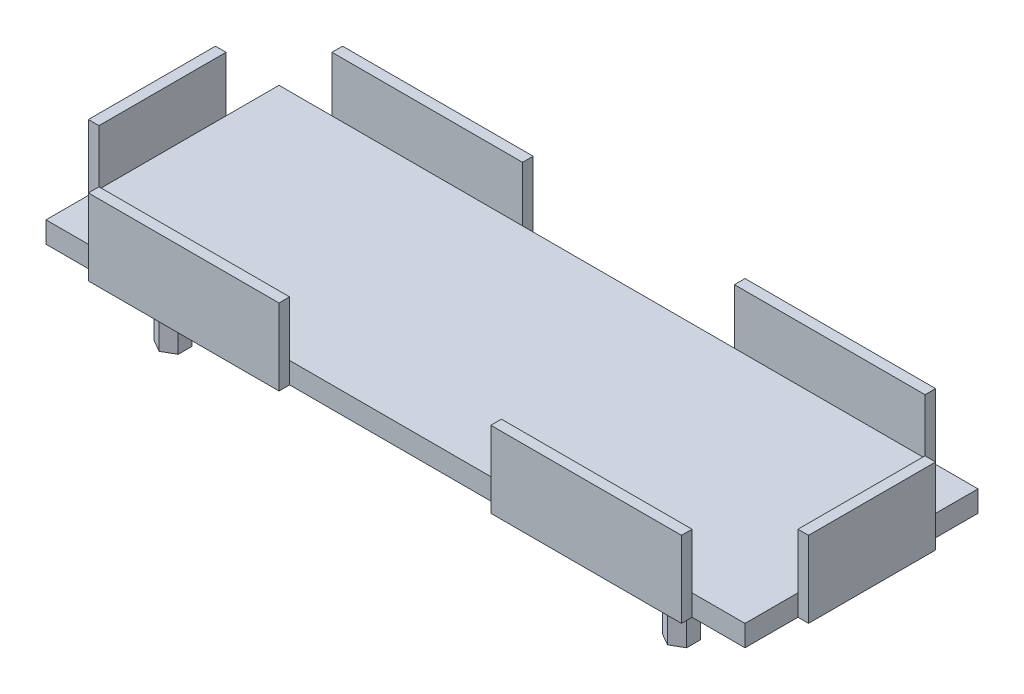
from build123d import *

# Parameters (mm, degrees)
SKETCH1_W           = 165
SKETCH1_H           = 55
BOSS_EXTRUDE1_DEPTH = 5
SKETCH2_W           = 2.5
SKETCH2_H           = 30
BOSS_EXTRUDE2_DEPTH = 18
SKETCH3_W           = 45
SKETCH3_H           = 2.5
BOSS_EXTRUDE3_DEPTH = 18
BOSS_EXTRUDE4_DEPTH = 12.75


with BuildPart() as part:
    # Sketch1 → Boss-Extrude1 (new body)
    with BuildSketch(Plane(origin=(0, 0, 0), x_dir=(1, 0, 0), z_dir=(0, 1, 0))):
        with Locations((82.5, 27.5)):
            Rectangle(SKETCH1_W, SKETCH1_H)
    extrude(amount=BOSS_EXTRUDE1_DEPTH)

    # Sketch2 → Boss-Extrude2 (add)
    with BuildSketch(Plane(origin=(0, 0, 0), x_dir=(1, 0, 0), z_dir=(0, 1, 0))):
        with Locations((166.25, 27.5)):
            Rectangle(SKETCH2_W, SKETCH2_H)
        with Locations((-1.25, 27.5)):
            Rectangle(SKETCH2_W, SKETCH2_H)
    extrude(amount=BOSS_EXTRUDE2_DEPTH)

    # Sketch3 → Boss-Extrude3 (add)
    with BuildSketch(Plane(origin=(0, 0, 0), x_dir=(1, 0, 0), z_dir=(0, 1, 0))):
        with Locations((130, 56.25)):
            Rectangle(SKETCH3_W, SKETCH3_H)
        with Locations((35, 56.25)):
            Rectangle(SKETCH3_W, SKETCH3_H)
        with Locations((130, -1.25)):
            Rectangle(SKETCH3_W, SKETCH3_H)
        with Locations((35, -1.25)):
            Rectangle(SKETCH3_W, SKETCH3_H)
    extrude(amount=BOSS_EXTRUDE3_DEPTH)

    # Sketch4 → Boss-Extrude4 (add)
    with BuildSketch(Plane.XZ):
        Polygon((139.65, -5.854551733), (139.65, -9.145448267), (142.5, -10.790896534), (145.35, -9.145448267), (145.35, -5.854551733), (142.5, -4.209103466), align=None)
        Polygon((22.5, -10.790896534), (25.35, -9.145448267), (25.35, -5.854551733), (22.5, -4.209103466), (19.65, -5.854551733), (19.65, -9.145448267), align=None)
        Polygon((22.5, -50.790896534), (25.35, -49.145448267), (25.35, -45.854551733), (22.5, -44.209103466), (19.65, -45.854551733), (19.65, -49.145448267), align=None)
        Polygon((145.35, -49.145448267), (145.35, -45.854551733), (142.5, -44.209103466), (139.65, -45.854551733), (139.65, -49.145448267), (142.5, -50.790896534), align=None)
    extrude(amount=BOSS_EXTRUDE4_DEPTH)


solid = part.part
